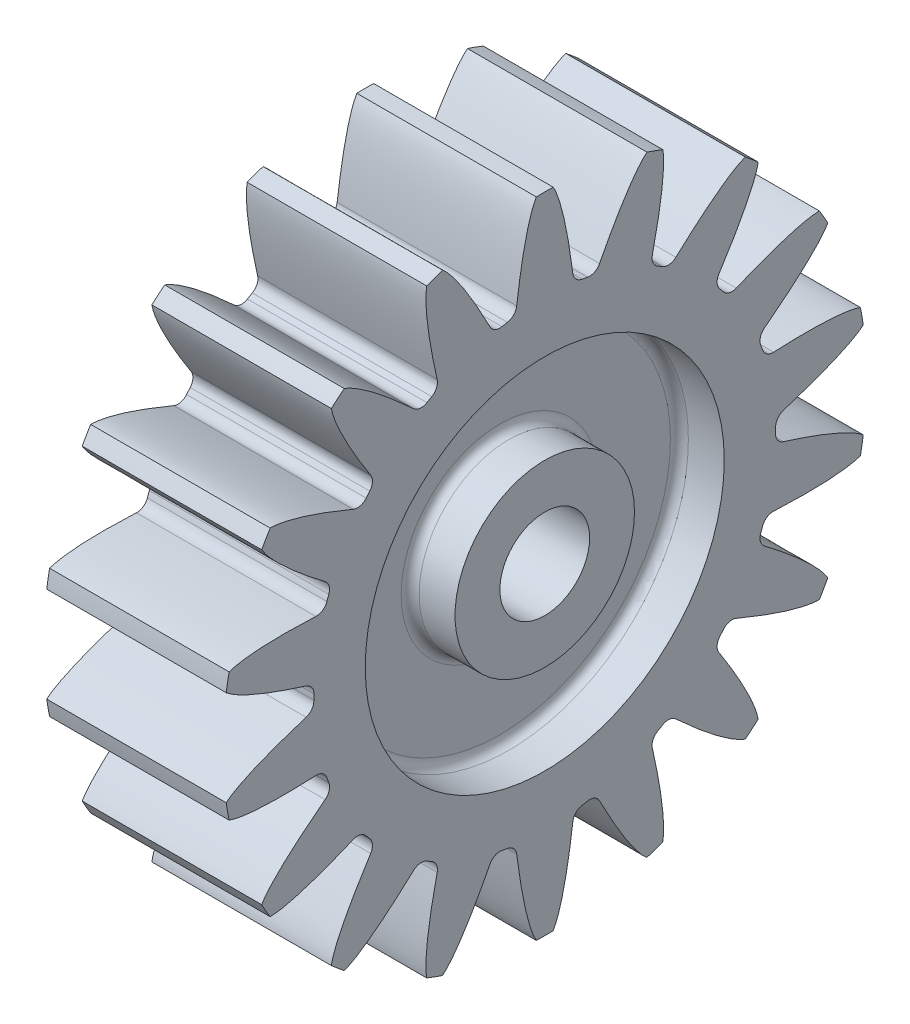
from build123d import *

# Parameters (mm, degrees)
SKETCH2_R           = 6.35
BOSS_EXTRUDE5_DEPTH = 12.7
SKETCH4_R           = 25.4
SKETCH4_R_2         = 12.7
CUT_EXTRUDE2_DEPTH  = 6.35
FILLET1_R           = 1.27
FILLET2_R           = 1.27


with BuildPart() as part:
    # Sketch2 → Boss-Extrude5 (new, symmetric)
    with BuildSketch(Plane(origin=(0, 0, 0), x_dir=(0, 0, -1), z_dir=(1, 0, 0))):
        with BuildLine():
            ThreePointArc((-5.281317508, 32.234619786), (-5.672113535, 32.168154367), (-6.062074189, 32.096951318))
            ThreePointArc((-6.062074189, 32.096951318), (-7.044683526, 32.228973245), (-7.753672239, 32.921999869))
            add(Edge.make_bspline(
                [(-7.753672239, 32.921999869), (-12.010390553, 41.167612908), (-14.459855462, 43.218564063)],
                knots=[2.37622597, 2.37622597, 2.37622597, 2.931936452, 2.931936452, 2.931936452], degree=2, weights=[1, 0.961645944, 1]))
            ThreePointArc((-14.459855462, 43.218564063), (-15.587009213, 42.824955848), (-16.703465563, 42.401956768))
            add(Edge.make_bspline(
                [(-16.703465563, 42.401956768), (-17.261538555, 39.256351339), (-15.222196069, 30.203679501)],
                knots=[3.351248855, 3.351248855, 3.351248855, 3.906959337, 3.906959337, 3.906959337], degree=2, weights=[1, 0.961645944, 1]))
            ThreePointArc((-15.222196069, 30.203679501), (-15.319844006, 29.217061146), (-15.98770437, 28.484317375))
            ThreePointArc((-15.98770437, 28.484317375), (-16.3322, 28.288200199), (-16.674290272, 28.08791682))
            ThreePointArc((-16.674290272, 28.08791682), (-17.642795173, 27.875904664), (-18.546055701, 28.284648248))
            add(Edge.make_bspline(
                [(-18.546055701, 28.284648248), (-25.366228242, 34.577106567), (-28.36943895, 35.666603893)],
                knots=[2.37622597, 2.37622597, 2.37622597, 2.931936452, 2.931936452, 2.931936452], degree=2, weights=[1, 0.961645944, 1]))
            ThreePointArc((-28.36943895, 35.666603893), (-29.293995074, 34.911223871), (-30.198446662, 34.131884196))
            add(Edge.make_bspline(
                [(-30.198446662, 34.131884196), (-29.647003315, 30.985109782), (-24.63445211, 23.175877066)],
                knots=[3.351248855, 3.351248855, 3.351248855, 3.906959337, 3.906959337, 3.906959337], degree=2, weights=[1, 0.961645944, 1]))
            ThreePointArc((-24.63445211, 23.175877066), (-24.388767805, 22.215361517), (-24.765738131, 21.298385906))
            ThreePointArc((-24.765738131, 21.298385906), (-25.022382108, 20.996271598), (-25.275340862, 20.69106502))
            ThreePointArc((-25.275340862, 20.69106502), (-26.112925343, 20.160590577), (-27.101511134, 20.235750611))
            add(Edge.make_bspline(
                [(-27.101511134, 20.235750611), (-35.66252444, 23.81609087), (-38.857249413, 23.812724911)],
                knots=[2.37622597, 2.37622597, 2.37622597, 2.931936452, 2.931936452, 2.931936452], degree=2, weights=[1, 0.961645944, 1]))
            ThreePointArc((-38.857249413, 23.812724911), (-39.467692797, 22.786683061), (-40.051049413, 21.745002657))
            add(Edge.make_bspline(
                [(-40.051049413, 21.745002657), (-38.456601932, 18.976606693), (-31.075429661, 13.352721818)],
                knots=[3.351248855, 3.351248855, 3.351248855, 3.906959337, 3.906959337, 3.906959337], degree=2, weights=[1, 0.961645944, 1]))
            ThreePointArc((-31.075429661, 13.352721818), (-30.516046266, 12.534161426), (-30.55665837, 11.543554765))
            ThreePointArc((-30.55665837, 11.543554765), (-30.694495642, 11.17188277), (-30.82781232, 10.798565412))
            ThreePointArc((-30.82781232, 10.798565412), (-31.43345133, 10.013611727), (-32.38812435, 9.746122803))
            add(Edge.make_bspline(
                [(-32.38812435, 9.746122803), (-41.657393867, 10.182503126), (-44.658302124, 9.086679866)],
                knots=[2.37622597, 2.37622597, 2.37622597, 2.931936452, 2.931936452, 2.931936452], degree=2, weights=[1, 0.961645944, 1]))
            ThreePointArc((-44.658302124, 9.086679866), (-44.881004287, 7.913731977), (-45.072904513, 6.735352875))
            add(Edge.make_bspline(
                [(-45.072904513, 6.735352875), (-42.627766797, 4.679244772), (-33.76825177, 1.919031253)],
                knots=[3.351248855, 3.351248855, 3.351248855, 3.906959337, 3.906959337, 3.906959337], degree=2, weights=[1, 0.961645944, 1]))
            ThreePointArc((-33.76825177, 1.919031253), (-32.962639179, 1.341156482), (-32.661994641, 0.396400555))
            ThreePointArc((-32.661994641, 0.396400555), (-32.6644, 0), (-32.661994641, -0.396400555))
            ThreePointArc((-32.661994641, -0.396400555), (-32.962639179, -1.341156482), (-33.76825177, -1.919031253))
            add(Edge.make_bspline(
                [(-33.76825177, -1.919031253), (-42.627766797, -4.679244772), (-45.072904513, -6.735352875)],
                knots=[2.37622597, 2.37622597, 2.37622597, 2.931936452, 2.931936452, 2.931936452], degree=2, weights=[1, 0.961645944, 1]))
            ThreePointArc((-45.072904513, -6.735352875), (-44.881004287, -7.913731977), (-44.658302124, -9.086679866))
            add(Edge.make_bspline(
                [(-44.658302124, -9.086679866), (-41.657393867, -10.182503126), (-32.38812435, -9.746122803)],
                knots=[3.351248855, 3.351248855, 3.351248855, 3.906959337, 3.906959337, 3.906959337], degree=2, weights=[1, 0.961645944, 1]))
            ThreePointArc((-32.38812435, -9.746122803), (-31.43345133, -10.013611727), (-30.82781232, -10.798565412))
            ThreePointArc((-30.82781232, -10.798565412), (-30.694495642, -11.17188277), (-30.55665837, -11.543554765))
            ThreePointArc((-30.55665837, -11.543554765), (-30.516046266, -12.534161426), (-31.075429661, -13.352721818))
            add(Edge.make_bspline(
                [(-31.075429661, -13.352721818), (-38.456601932, -18.976606693), (-40.051049413, -21.745002657)],
                knots=[2.37622597, 2.37622597, 2.37622597, 2.931936452, 2.931936452, 2.931936452], degree=2, weights=[1, 0.961645944, 1]))
            ThreePointArc((-40.051049413, -21.745002657), (-39.467692797, -22.786683061), (-38.857249413, -23.812724911))
            add(Edge.make_bspline(
                [(-38.857249413, -23.812724911), (-35.66252444, -23.81609087), (-27.101511134, -20.235750611)],
                knots=[3.351248855, 3.351248855, 3.351248855, 3.906959337, 3.906959337, 3.906959337], degree=2, weights=[1, 0.961645944, 1]))
            ThreePointArc((-27.101511134, -20.235750611), (-26.112925343, -20.160590577), (-25.275340862, -20.69106502))
            ThreePointArc((-25.275340862, -20.69106502), (-25.022382108, -20.996271598), (-24.765738131, -21.298385906))
            ThreePointArc((-24.765738131, -21.298385906), (-24.388767805, -22.215361517), (-24.63445211, -23.175877066))
            add(Edge.make_bspline(
                [(-24.63445211, -23.175877066), (-29.647003315, -30.985109782), (-30.198446662, -34.131884196)],
                knots=[2.37622597, 2.37622597, 2.37622597, 2.931936452, 2.931936452, 2.931936452], degree=2, weights=[1, 0.961645944, 1]))
            ThreePointArc((-30.198446662, -34.131884196), (-29.293995074, -34.911223871), (-28.36943895, -35.666603893))
            add(Edge.make_bspline(
                [(-28.36943895, -35.666603893), (-25.366228242, -34.577106567), (-18.546055701, -28.284648248)],
                knots=[3.351248855, 3.351248855, 3.351248855, 3.906959337, 3.906959337, 3.906959337], degree=2, weights=[1, 0.961645944, 1]))
            ThreePointArc((-18.546055701, -28.284648248), (-17.642795173, -27.875904664), (-16.674290272, -28.08791682))
            ThreePointArc((-16.674290272, -28.08791682), (-16.3322, -28.288200199), (-15.98770437, -28.484317375))
            ThreePointArc((-15.98770437, -28.484317375), (-15.319844006, -29.217061146), (-15.222196069, -30.203679501))
            add(Edge.make_bspline(
                [(-15.222196069, -30.203679501), (-17.261538555, -39.256351339), (-16.703465563, -42.401956768)],
                knots=[2.37622597, 2.37622597, 2.37622597, 2.931936452, 2.931936452, 2.931936452], degree=2, weights=[1, 0.961645944, 1]))
            ThreePointArc((-16.703465563, -42.401956768), (-15.587009213, -42.824955848), (-14.459855462, -43.218564063))
            add(Edge.make_bspline(
                [(-14.459855462, -43.218564063), (-12.010390552, -41.167612908), (-7.753672239, -32.921999869)],
                knots=[3.351248855, 3.351248855, 3.351248855, 3.906959337, 3.906959337, 3.906959337], degree=2, weights=[1, 0.961645944, 1]))
            ThreePointArc((-7.753672239, -32.921999869), (-7.044683526, -32.228973245), (-6.062074189, -32.096951318))
            ThreePointArc((-6.062074189, -32.096951318), (-5.672113535, -32.168154367), (-5.281317508, -32.234619786))
            ThreePointArc((-5.281317508, -32.234619786), (-4.403120924, -32.694752002), (-3.973918527, -33.588472429))
            add(Edge.make_bspline(
                [(-3.973918527, -33.588472429), (-2.794077492, -42.792697563), (-1.1938, -45.557727568)],
                knots=[2.37622597, 2.37622597, 2.37622597, 2.931936452, 2.931936452, 2.931936452], degree=2, weights=[1, 0.961645944, 1]))
            ThreePointArc((-1.1938, -45.557727568), (0, -45.573366121), (1.1938, -45.557727568))
            add(Edge.make_bspline(
                [(1.1938, -45.557727568), (2.794077492, -42.792697563), (3.973918527, -33.588472429)],
                knots=[3.351248855, 3.351248855, 3.351248855, 3.906959337, 3.906959337, 3.906959337], degree=2, weights=[1, 0.961645944, 1]))
            ThreePointArc((3.973918527, -33.588472429), (4.403120924, -32.694752002), (5.281317508, -32.234619786))
            ThreePointArc((5.281317508, -32.234619786), (5.672113535, -32.168154367), (6.062074189, -32.096951318))
            ThreePointArc((6.062074189, -32.096951318), (7.044683526, -32.228973245), (7.753672239, -32.921999869))
            add(Edge.make_bspline(
                [(7.753672239, -32.921999869), (12.010390552, -41.167612908), (14.459855462, -43.218564063)],
                knots=[2.37622597, 2.37622597, 2.37622597, 2.931936452, 2.931936452, 2.931936452], degree=2, weights=[1, 0.961645944, 1]))
            ThreePointArc((14.459855462, -43.218564063), (15.587009213, -42.824955848), (16.703465563, -42.401956768))
            add(Edge.make_bspline(
                [(16.703465563, -42.401956768), (17.261538555, -39.256351339), (15.222196069, -30.203679501)],
                knots=[3.351248855, 3.351248855, 3.351248855, 3.906959337, 3.906959337, 3.906959337], degree=2, weights=[1, 0.961645944, 1]))
            ThreePointArc((15.222196069, -30.203679501), (15.319844006, -29.217061146), (15.98770437, -28.484317375))
            ThreePointArc((15.98770437, -28.484317375), (16.3322, -28.288200199), (16.674290272, -28.08791682))
            ThreePointArc((16.674290272, -28.08791682), (17.642795173, -27.875904664), (18.546055701, -28.284648248))
            add(Edge.make_bspline(
                [(18.546055701, -28.284648248), (25.366228242, -34.577106566), (28.36943895, -35.666603893)],
                knots=[2.37622597, 2.37622597, 2.37622597, 2.931936452, 2.931936452, 2.931936452], degree=2, weights=[1, 0.961645944, 1]))
            ThreePointArc((28.36943895, -35.666603893), (29.293995074, -34.911223871), (30.198446662, -34.131884196))
            add(Edge.make_bspline(
                [(30.198446662, -34.131884196), (29.647003315, -30.985109782), (24.63445211, -23.175877066)],
                knots=[3.351248855, 3.351248855, 3.351248855, 3.906959337, 3.906959337, 3.906959337], degree=2, weights=[1, 0.961645944, 1]))
            ThreePointArc((24.63445211, -23.175877066), (24.388767805, -22.215361517), (24.765738131, -21.298385906))
            ThreePointArc((24.765738131, -21.298385906), (25.022382108, -20.996271598), (25.275340862, -20.69106502))
            ThreePointArc((25.275340862, -20.69106502), (26.112925343, -20.160590577), (27.101511134, -20.235750611))
            add(Edge.make_bspline(
                [(27.101511134, -20.235750611), (35.66252444, -23.81609087), (38.857249413, -23.812724911)],
                knots=[2.37622597, 2.37622597, 2.37622597, 2.931936452, 2.931936452, 2.931936452], degree=2, weights=[1, 0.961645944, 1]))
            ThreePointArc((38.857249413, -23.812724911), (39.467692797, -22.786683061), (40.051049413, -21.745002657))
            add(Edge.make_bspline(
                [(40.051049413, -21.745002657), (38.456601932, -18.976606693), (31.075429661, -13.352721818)],
                knots=[3.351248855, 3.351248855, 3.351248855, 3.906959337, 3.906959337, 3.906959337], degree=2, weights=[1, 0.961645944, 1]))
            ThreePointArc((31.075429661, -13.352721818), (30.516046266, -12.534161426), (30.55665837, -11.543554765))
            ThreePointArc((30.55665837, -11.543554765), (30.694495642, -11.17188277), (30.82781232, -10.798565412))
            ThreePointArc((30.82781232, -10.798565412), (31.43345133, -10.013611727), (32.38812435, -9.746122803))
            add(Edge.make_bspline(
                [(32.38812435, -9.746122803), (41.657393867, -10.182503126), (44.658302124, -9.086679866)],
                knots=[2.37622597, 2.37622597, 2.37622597, 2.931936452, 2.931936452, 2.931936452], degree=2, weights=[1, 0.961645944, 1]))
            ThreePointArc((44.658302124, -9.086679866), (44.881004287, -7.913731977), (45.072904513, -6.735352875))
            add(Edge.make_bspline(
                [(45.072904513, -6.735352875), (42.627766797, -4.679244772), (33.76825177, -1.919031253)],
                knots=[3.351248855, 3.351248855, 3.351248855, 3.906959337, 3.906959337, 3.906959337], degree=2, weights=[1, 0.961645944, 1]))
            ThreePointArc((33.76825177, -1.919031253), (32.962639179, -1.341156482), (32.661994641, -0.396400555))
            ThreePointArc((32.661994641, -0.396400555), (32.6644, 0), (32.661994641, 0.396400555))
            ThreePointArc((32.661994641, 0.396400555), (32.962639179, 1.341156482), (33.76825177, 1.919031253))
            add(Edge.make_bspline(
                [(33.76825177, 1.919031253), (42.627766797, 4.679244772), (45.072904513, 6.735352875)],
                knots=[2.37622597, 2.37622597, 2.37622597, 2.931936452, 2.931936452, 2.931936452], degree=2, weights=[1, 0.961645944, 1]))
            ThreePointArc((45.072904513, 6.735352875), (44.881004287, 7.913731977), (44.658302124, 9.086679866))
            add(Edge.make_bspline(
                [(44.658302124, 9.086679866), (41.657393867, 10.182503126), (32.38812435, 9.746122803)],
                knots=[3.351248855, 3.351248855, 3.351248855, 3.906959337, 3.906959337, 3.906959337], degree=2, weights=[1, 0.961645944, 1]))
            ThreePointArc((32.38812435, 9.746122803), (31.43345133, 10.013611727), (30.82781232, 10.798565412))
            ThreePointArc((30.82781232, 10.798565412), (30.694495642, 11.17188277), (30.55665837, 11.543554765))
            ThreePointArc((30.55665837, 11.543554765), (30.516046266, 12.534161426), (31.075429661, 13.352721818))
            add(Edge.make_bspline(
                [(31.075429661, 13.352721818), (38.456601932, 18.976606693), (40.051049413, 21.745002657)],
                knots=[2.37622597, 2.37622597, 2.37622597, 2.931936452, 2.931936452, 2.931936452], degree=2, weights=[1, 0.961645944, 1]))
            ThreePointArc((40.051049413, 21.745002657), (39.467692797, 22.786683061), (38.857249413, 23.812724911))
            add(Edge.make_bspline(
                [(38.857249413, 23.812724911), (35.66252444, 23.81609087), (27.101511134, 20.235750611)],
                knots=[3.351248855, 3.351248855, 3.351248855, 3.906959337, 3.906959337, 3.906959337], degree=2, weights=[1, 0.961645944, 1]))
            ThreePointArc((27.101511134, 20.235750611), (26.112925343, 20.160590577), (25.275340862, 20.69106502))
            ThreePointArc((25.275340862, 20.69106502), (25.022382108, 20.996271598), (24.765738131, 21.298385906))
            ThreePointArc((24.765738131, 21.298385906), (24.388767805, 22.215361517), (24.63445211, 23.175877066))
            add(Edge.make_bspline(
                [(24.63445211, 23.175877066), (29.647003315, 30.985109782), (30.198446662, 34.131884196)],
                knots=[2.37622597, 2.37622597, 2.37622597, 2.931936452, 2.931936452, 2.931936452], degree=2, weights=[1, 0.961645944, 1]))
            ThreePointArc((30.198446662, 34.131884196), (29.293995074, 34.911223871), (28.36943895, 35.666603893))
            add(Edge.make_bspline(
                [(28.36943895, 35.666603893), (25.366228242, 34.577106567), (18.546055701, 28.284648248)],
                knots=[3.351248855, 3.351248855, 3.351248855, 3.906959337, 3.906959337, 3.906959337], degree=2, weights=[1, 0.961645944, 1]))
            ThreePointArc((18.546055701, 28.284648248), (17.642795173, 27.875904664), (16.674290272, 28.08791682))
            ThreePointArc((16.674290272, 28.08791682), (16.3322, 28.288200199), (15.98770437, 28.484317375))
            ThreePointArc((15.98770437, 28.484317375), (15.319844006, 29.217061146), (15.222196069, 30.203679501))
            add(Edge.make_bspline(
                [(15.222196069, 30.203679501), (17.261538555, 39.256351339), (16.703465563, 42.401956768)],
                knots=[2.37622597, 2.37622597, 2.37622597, 2.931936452, 2.931936452, 2.931936452], degree=2, weights=[1, 0.961645944, 1]))
            ThreePointArc((16.703465563, 42.401956768), (15.587009213, 42.824955848), (14.459855462, 43.218564063))
            add(Edge.make_bspline(
                [(14.459855462, 43.218564063), (12.010390552, 41.167612908), (7.753672239, 32.921999869)],
                knots=[3.351248855, 3.351248855, 3.351248855, 3.906959337, 3.906959337, 3.906959337], degree=2, weights=[1, 0.961645944, 1]))
            ThreePointArc((7.753672239, 32.921999869), (7.044683526, 32.228973245), (6.062074189, 32.096951318))
            ThreePointArc((6.062074189, 32.096951318), (5.672113535, 32.168154367), (5.281317508, 32.234619786))
            ThreePointArc((5.281317508, 32.234619786), (4.403120924, 32.694752002), (3.973918527, 33.588472429))
            add(Edge.make_bspline(
                [(3.973918527, 33.588472429), (2.794077492, 42.792697563), (1.1938, 45.557727568)],
                knots=[2.37622597, 2.37622597, 2.37622597, 2.931936452, 2.931936452, 2.931936452], degree=2, weights=[1, 0.961645944, 1]))
            ThreePointArc((1.1938, 45.557727568), (0, 45.573366121), (-1.1938, 45.557727568))
            add(Edge.make_bspline(
                [(-1.1938, 45.557727568), (-2.794077492, 42.792697563), (-3.973918527, 33.588472429)],
                knots=[3.351248855, 3.351248855, 3.351248855, 3.906959337, 3.906959337, 3.906959337], degree=2, weights=[1, 0.961645944, 1]))
            ThreePointArc((-3.973918527, 33.588472429), (-4.403120924, 32.694752002), (-5.281317508, 32.234619786))
        make_face()
        Circle(SKETCH2_R, mode=Mode.SUBTRACT)
    extrude(amount=BOSS_EXTRUDE5_DEPTH, both=True)

    # Sketch4 → Cut-Extrude2 (cut)
    with BuildSketch(Plane(origin=(12.7, 0, 0), x_dir=(0, 0, -1), z_dir=(1, 0, 0))):
        Circle(SKETCH4_R)
        Circle(SKETCH4_R_2, mode=Mode.SUBTRACT)
    cut_extrude2 = extrude(amount=-CUT_EXTRUDE2_DEPTH, mode=Mode.SUBTRACT)

    # Mirror2: Cut-Extrude2 across plane
    add(cut_extrude2.mirror(Plane(origin=(0, 0, 0), x_dir=(0, 0, 1), z_dir=(1, 0, 0))), mode=Mode.SUBTRACT)

    # Fillet1
    fillet1_edges = [part.edges().sort_by_distance(p)[0] for p in [
        (6.35, 0, 25.4),
        (-6.35, 0, 25.4),
    ]]
    fillet(fillet1_edges, radius=FILLET1_R)

    # Fillet2
    fillet2_edges = [part.edges().sort_by_distance(p)[0] for p in [
        (6.35, 0, 12.7),
        (-6.35, 0, 12.7),
    ]]
    fillet(fillet2_edges, radius=FILLET2_R)


solid = part.part
